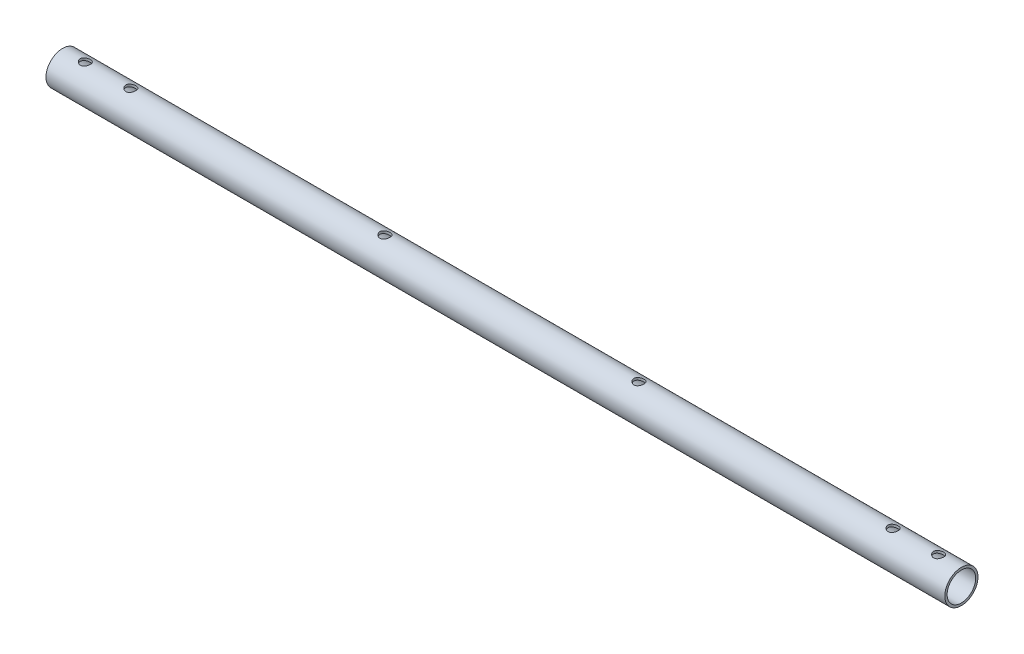
from build123d import *

# Parameters (mm, degrees)
SKETCH1_R               = 36.5
SKETCH1_R_2             = 31.34
BOSS_EXTRUDE1_DEPTH     = 1975
CUT_EXTRUDE2_DEPTH      = 1976.674441805
CUT_EXTRUDE2_DEPTH_BACK = 1976.674441805
SKETCH2_R               = 11
SKETCH3_R               = 11
CUT_EXTRUDE3_DEPTH      = 1976.674441908
LPATTERN1_COUNT         = 4
LPATTERN1_PITCH         = 558.3333
CUT_EXTRUDE4_DEPTH      = 1976.674441908
CUT_EXTRUDE4_DEPTH_BACK = 1976.674441908
SKETCH4_R               = 11


with BuildPart() as part:
    # Sketch1 → Boss-Extrude1 (new body)
    with BuildSketch(Plane(origin=(0, 0, 0), x_dir=(0, 0, -1), z_dir=(1, 0, 0))):
        with Locations(Location((0, 0, 0), (0, 0, 180))):
            Circle(SKETCH1_R)
        with Locations(Location((0, 0, 0), (0, 0, 180))):
            Circle(SKETCH1_R_2, mode=Mode.SUBTRACT)
    extrude(amount=BOSS_EXTRUDE1_DEPTH)

    # Sketch2 → Cut-Extrude2 (cut, two sides: drawn at the far end of the back side and taken through both)
    with BuildSketch(Plane(origin=(0, 0, 0), x_dir=(1, 0, 0), z_dir=(0, 1, 0)).offset(-CUT_EXTRUDE2_DEPTH_BACK)):
        with Locations(Location((50, 0, 0), (0, 0, 270))):
            Circle(SKETCH2_R)
    extrude(amount=CUT_EXTRUDE2_DEPTH + CUT_EXTRUDE2_DEPTH_BACK, mode=Mode.SUBTRACT)

    # Sketch3 → Cut-Extrude3 (cut, symmetric)
    with BuildSketch(Plane(origin=(0, 0, 0), x_dir=(1, 0, 0), z_dir=(0, 1, 0))):
        with Locations(Location((150, 0, 0), (0, 0, 270))):
            Circle(SKETCH3_R)
    cut_extrude3 = extrude(amount=CUT_EXTRUDE3_DEPTH, both=True, mode=Mode.SUBTRACT)

    # LPattern1: Cut-Extrude3 ×4
    with Locations(*[(i * LPATTERN1_PITCH, 0, 0) for i in range(1, LPATTERN1_COUNT)]):
        add(cut_extrude3, mode=Mode.SUBTRACT)

    # Sketch4 → Cut-Extrude4 (cut, two sides: drawn at the far end of the back side and taken through both)
    with BuildSketch(Plane(origin=(0, 0, 0), x_dir=(1, 0, 0), z_dir=(0, 1, 0)).offset(-CUT_EXTRUDE4_DEPTH_BACK)):
        with Locations(Location((1924.9999, 0, 0), (0, 0, 270))):
            Circle(SKETCH4_R)
    extrude(amount=CUT_EXTRUDE4_DEPTH + CUT_EXTRUDE4_DEPTH_BACK, mode=Mode.SUBTRACT)


solid = part.part
